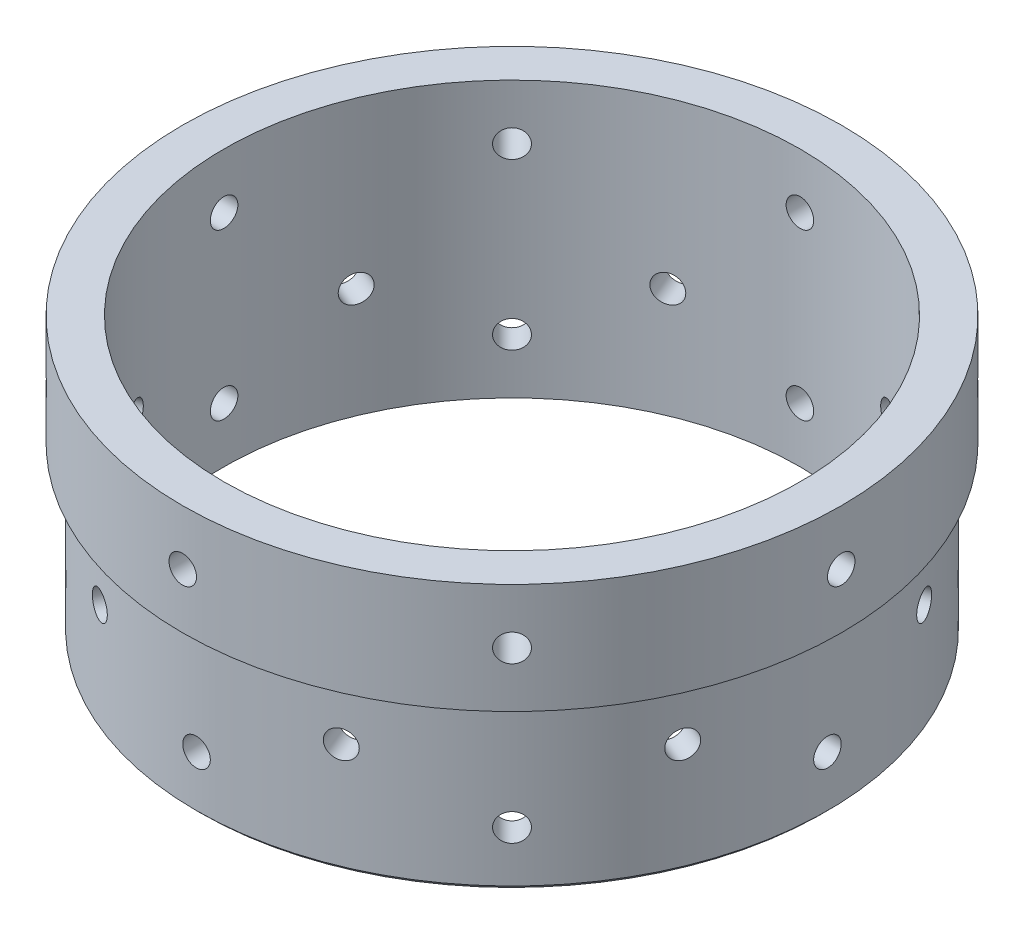
from build123d import *

# Parameters (mm, degrees)
SKETCH1_R           = 76.0095
SKETCH1_R_2         = 66.4845
BOSS_EXTRUDE1_DEPTH = 25.4
BOSS_EXTRUDE2_START = -38.1
SKETCH1_3_R         = 72.8345
SKETCH1_3_R_2       = 66.4845
BOSS_EXTRUDE2_DEPTH = 38.1
SKETCH2_R           = 3.175
CUT_EXTRUDE1_DEPTH  = 115.046035356
CHAMFER1_SIZE       = 1
CIRPATTERN1_COUNT   = 8
SKETCH3_R           = 3.175
CUT_EXTRUDE2_DEPTH  = 38.1
CIRPATTERN2_COUNT   = 8


with BuildPart() as part:
    # Sketch1 → Boss-Extrude1 (new body)
    with BuildSketch(Plane(origin=(0, 0, 0), x_dir=(1, 0, 0), z_dir=(0, 1, 0))):
        Circle(SKETCH1_R)
        Circle(SKETCH1_R_2, mode=Mode.SUBTRACT)
    extrude(amount=BOSS_EXTRUDE1_DEPTH)

    # Sketch1<3> → Boss-Extrude2 (add)
    with BuildSketch(Plane(origin=(0, 0, 0), x_dir=(1, 0, 0), z_dir=(0, 1, 0)).offset(BOSS_EXTRUDE2_START)):
        Circle(SKETCH1_3_R)
        Circle(SKETCH1_3_R_2, mode=Mode.SUBTRACT)
    extrude(amount=BOSS_EXTRUDE2_DEPTH)

    # Sketch2 → Cut-Extrude1 (cut, through all)
    with BuildSketch(Plane.XY):
        with Locations((0, 12.7)):
            Circle(SKETCH2_R)
        with Locations((0, -25.4)):
            Circle(SKETCH2_R)
    cut_extrude1 = extrude(amount=-CUT_EXTRUDE1_DEPTH, mode=Mode.SUBTRACT)

    # Chamfer1
    chamfer1_edges = [part.edges().sort_by_distance(p)[0] for p in [
        (-72.8345, -38.1, 0),
    ]]
    chamfer(chamfer1_edges, length=CHAMFER1_SIZE)

    # CirPattern1: Cut-Extrude1 ×8 about axis
    cirpattern1_axis = Axis((0, 25.4, 0), (0, -1, 0))
    for i in range(1, CIRPATTERN1_COUNT):
        add(cut_extrude1.rotate(cirpattern1_axis, i * 360 / CIRPATTERN1_COUNT), mode=Mode.SUBTRACT)

    # Sketch3 → Cut-Extrude2 (cut)
    with BuildSketch(Plane(origin=(-29.087576352, 0, 70.223621326), x_dir=(0, -1, 0), z_dir=(-0.3826834323650906, 0, 0.9238795325112865))):
        with Locations((12.7, 0)):
            Circle(SKETCH3_R)
    cut_extrude2 = extrude(amount=-CUT_EXTRUDE2_DEPTH, mode=Mode.SUBTRACT)

    # CirPattern2: Cut-Extrude2 ×8 about axis
    cirpattern2_axis = Axis((0, 25.4, 0), (0, -1, 0))
    for i in range(1, CIRPATTERN2_COUNT):
        add(cut_extrude2.rotate(cirpattern2_axis, i * 360 / CIRPATTERN2_COUNT), mode=Mode.SUBTRACT)


solid = part.part
